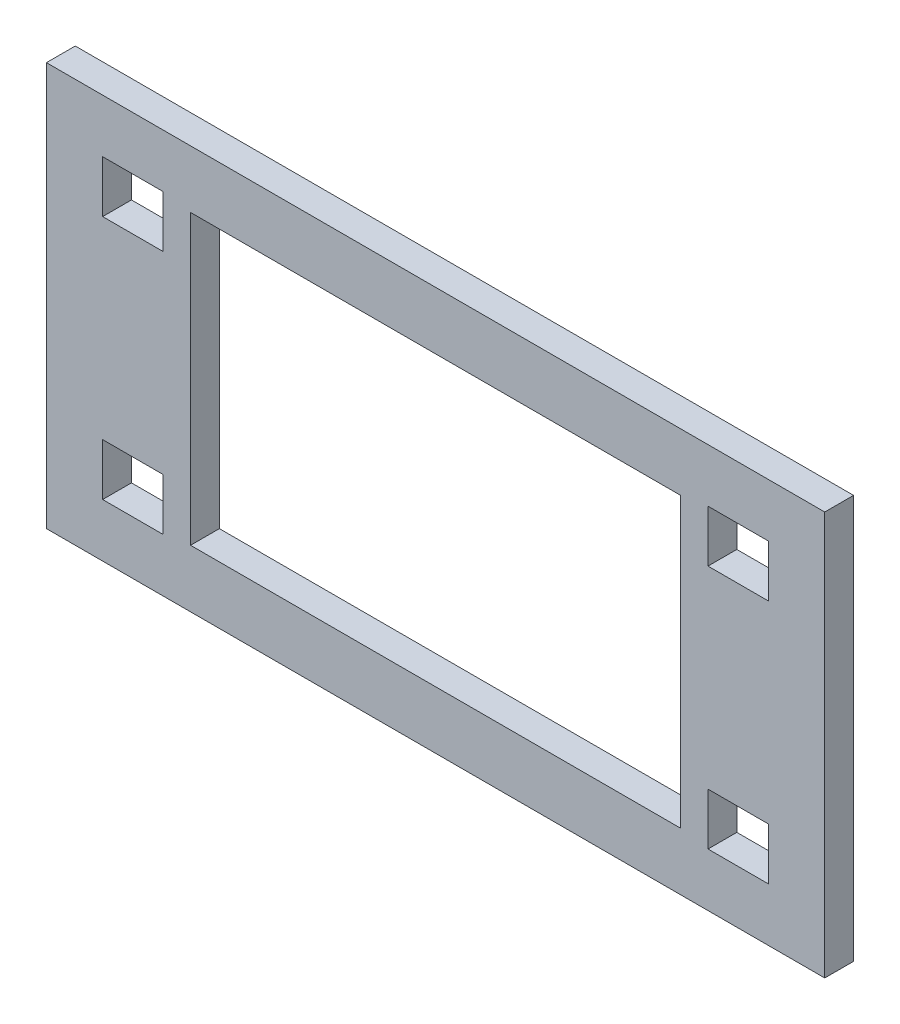
from build123d import *

# Parameters (mm, degrees)
SKETCH_1_W                               = 54
SKETCH_1_H                               = 28
GAUGE_PLATE_2MM_DEPTH                    = 2
OPEN_WINDOW_START                        = -0.1
SKETCH_2_W                               = 34
SKETCH_2_H                               = 20
OPEN_WINDOW_DEPTH                        = 2.2
SAME_SLOTS_AS_SENSOR_BRACKET_42X17_START = -0.1
SKETCH_3_W                               = 4.2
SKETCH_3_H                               = 3.6
SAME_SLOTS_AS_SENSOR_BRACKET_42X17_DEPTH = 2.2


with BuildPart() as part:
    # 草图1 → Gauge_plate_2mm (new body)
    with BuildSketch(Plane.XY):
        Rectangle(SKETCH_1_W, SKETCH_1_H)
    extrude(amount=GAUGE_PLATE_2MM_DEPTH)

    # 草图2 → Open_window (cut)
    with BuildSketch(Plane.XY.offset(OPEN_WINDOW_START)):
        Rectangle(SKETCH_2_W, SKETCH_2_H)
    extrude(amount=OPEN_WINDOW_DEPTH, mode=Mode.SUBTRACT)

    # 草图3 → Same_slots_as_sensor_bracket_42x17 (cut)
    with BuildSketch(Plane.XY.offset(SAME_SLOTS_AS_SENSOR_BRACKET_42X17_START)):
        with Locations((-21, -8.5)):
            Rectangle(SKETCH_3_W, SKETCH_3_H)
        with Locations((-21, 8.5)):
            Rectangle(SKETCH_3_W, SKETCH_3_H)
        with Locations((21, -8.5)):
            Rectangle(SKETCH_3_W, SKETCH_3_H)
        with Locations((21, 8.5)):
            Rectangle(SKETCH_3_W, SKETCH_3_H)
    extrude(amount=SAME_SLOTS_AS_SENSOR_BRACKET_42X17_DEPTH, mode=Mode.SUBTRACT)


solid = part.part
